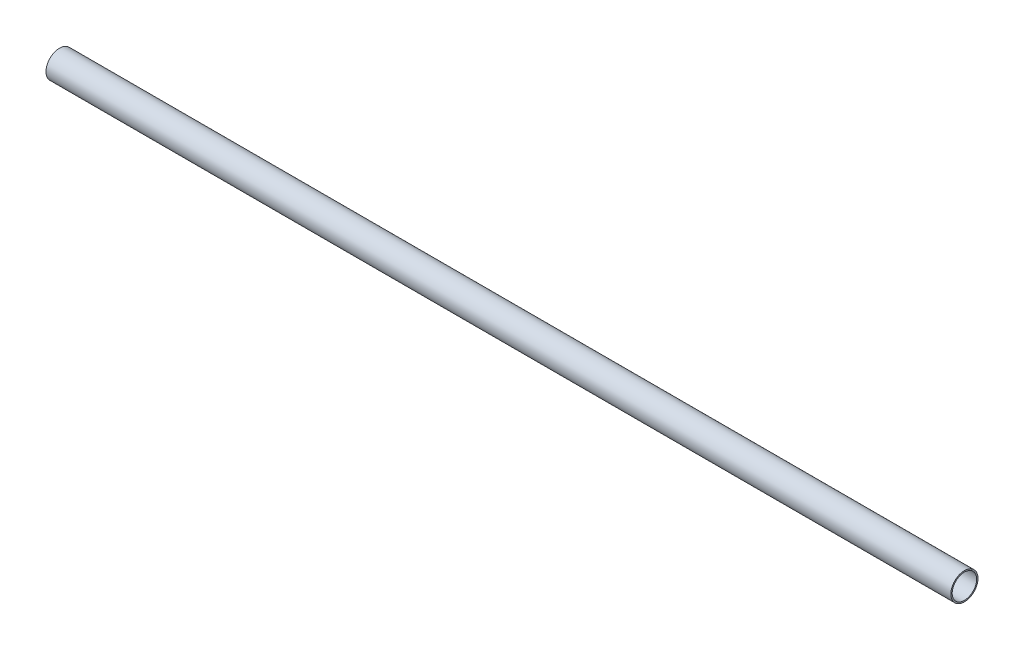
from build123d import *

# Parameters (mm, degrees)
SKETCH1_R           = 15
SKETCH1_R_2         = 13.5
BOSS_EXTRUDE1_DEPTH = 1000


with BuildPart() as part:
    # Sketch1 → Boss-Extrude1 (new body)
    with BuildSketch(Plane(origin=(0, 0, 0), x_dir=(0, 0, -1), z_dir=(1, 0, 0))):
        Circle(SKETCH1_R)
        Circle(SKETCH1_R_2, mode=Mode.SUBTRACT)
    extrude(amount=BOSS_EXTRUDE1_DEPTH)


solid = part.part
